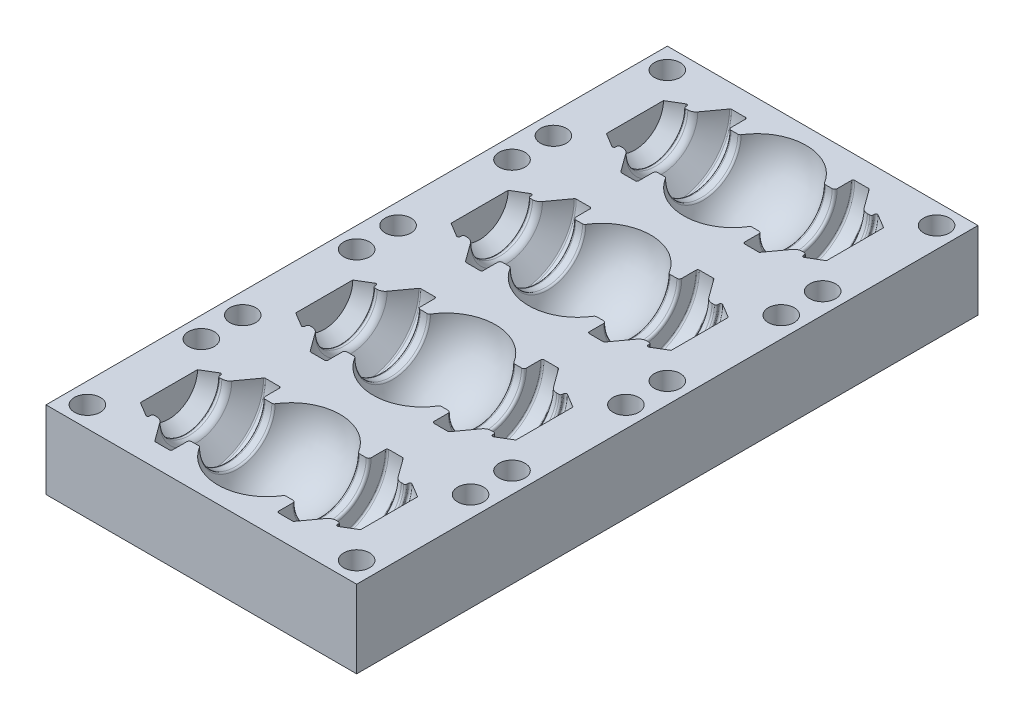
from build123d import *

# Parameters (mm, degrees)
SKETCH1_W                             = 38.1
SKETCH1_H                             = 19.05
BOSS_EXTRUDE1_DEPTH                   = 9.525
F_1_8_0_125_DIAMETER_HOLE1_AT_2_COUNT = 2
F_1_8_0_125_DIAMETER_HOLE1_AT_2_PITCH = 35.853609302
F_1_8_0_125_DIAMETER_HOLE1_AT_3_COUNT = 2
F_1_8_0_125_DIAMETER_HOLE1_AT_3_PITCH = 33.02
F_1_8_0_125_DIAMETER_HOLE1_AT_4_COUNT = 2
F_1_8_0_125_DIAMETER_HOLE1_AT_4_PITCH = 13.97
LPATTERN2_COUNT                       = 4
LPATTERN2_PITCH                       = 19.05


with BuildPart() as part:
    # Sketch1 → Boss-Extrude1 (new body)
    with BuildSketch(Plane(origin=(0, 0, 0), x_dir=(1, 0, 0), z_dir=(0, 1, 0))):
        Rectangle(SKETCH1_W, SKETCH1_H)
    boss_extrude1 = extrude(amount=-BOSS_EXTRUDE1_DEPTH)

    # Sketch2 → Cut-Revolve1 (revolve, cut)
    with BuildSketch(Plane(origin=(0, 0, 0), x_dir=(1, 0, 0), z_dir=(0, 1, 0))):
        with BuildLine():
            Line((-5.370288633, 4.5), (-6.2, 4.5))
            ThreePointArc((-6.2, 4.5), (-6.412132034, 4.587867966), (-6.5, 4.8))
            Line((-6.5, 4.8), (-6.5, 6.55))
            ThreePointArc((-6.5, 6.55), (-6.558578644, 6.691421356), (-6.7, 6.75))
            Line((-6.7, 6.75), (-8.398155082, 6.75))
            ThreePointArc((-8.398155082, 6.75), (-8.488910611, 6.728222989), (-8.559902299, 6.66763434))
            Line((-8.559902299, 6.66763434), (-10.200488507, 4.411828302))
            ThreePointArc((-10.200488507, 4.411828302), (-10.555446947, 4.108885053), (-11.009224592, 4))
            Line((-11.009224592, 4), (-11.3, 4))
            ThreePointArc((-11.3, 4), (-11.441421356, 4.058578644), (-11.5, 4.2))
            Line((-11.5, 4.2), (-11.5, 4.346761924))
            ThreePointArc((-11.5, 4.346761924), (-11.601460237, 4.520801906), (-11.802899151, 4.518260509))
            Line((-11.802899151, 4.518260509), (-13.5, 3.5))
            Line((-13.5, 3.5), (-13.5, 0))
            Line((-13.5, 0), (13.5, 0))
            Line((13.5, 0), (13.5, 3.5))
            Line((13.5, 3.5), (11.802899151, 4.518260509))
            ThreePointArc((11.802899151, 4.518260509), (11.601460237, 4.520801906), (11.5, 4.346761924))
            Line((11.5, 4.346761924), (11.5, 4.2))
            ThreePointArc((11.5, 4.2), (11.441421356, 4.058578644), (11.3, 4))
            Line((11.3, 4), (11.009224592, 4))
            ThreePointArc((11.009224592, 4), (10.555446947, 4.108885053), (10.200488507, 4.411828302))
            Line((10.200488507, 4.411828302), (8.559902299, 6.66763434))
            ThreePointArc((8.559902299, 6.66763434), (8.488910611, 6.728222989), (8.398155082, 6.75))
            Line((8.398155082, 6.75), (6.7, 6.75))
            ThreePointArc((6.7, 6.75), (6.558578644, 6.691421356), (6.5, 6.55))
            Line((6.5, 6.55), (6.5, 4.8))
            ThreePointArc((6.5, 4.8), (6.412132034, 4.587867966), (6.2, 4.5))
            Line((6.2, 4.5), (5.370288633, 4.5))
            ThreePointArc((5.370288633, 4.5), (5.223981013, 4.538095284), (5.114830928, 4.642706131))
            ThreePointArc((5.114830928, 4.642706131), (0, 7.5), (-5.114830928, 4.642706131))
            ThreePointArc((-5.114830928, 4.642706131), (-5.223981013, 4.538095284), (-5.370288633, 4.5))
        make_face()
    cut_revolve1 = revolve(axis=Axis((-13.5, 0, 0), (1, 0, 0)), mode=Mode.SUBTRACT)

    # Sketch6 → 1/8 (0.125) Diameter Hole1 (revolve, cut)
    with BuildSketch(Plane(origin=(-16.51, 0, -6.985), x_dir=(0, 0, 1), z_dir=(1, 0, 0))):
        Polygon((0, 0), (0, 7.303866233), (1.5875, 6.35), (1.5875, 0), align=None)
    f_1_8_0_125_diameter_hole1 = revolve(axis=Axis((-16.51, 6.35, -6.985), (0, -1, 0)), mode=Mode.SUBTRACT)

    # 1/8 (0.125) Diameter Hole1 at 2: 1/8 (0.125) Diameter Hole1 ×2
    with Locations(*[Vector(0.9209672510685588, 0, 0.389639990836698) * (i * F_1_8_0_125_DIAMETER_HOLE1_AT_2_PITCH) for i in range(1, F_1_8_0_125_DIAMETER_HOLE1_AT_2_COUNT)]):
        add(f_1_8_0_125_diameter_hole1, mode=Mode.SUBTRACT)

    # 1/8 (0.125) Diameter Hole1 at 3: 1/8 (0.125) Diameter Hole1 ×2
    with Locations(*[(i * F_1_8_0_125_DIAMETER_HOLE1_AT_3_PITCH, 0, 0) for i in range(1, F_1_8_0_125_DIAMETER_HOLE1_AT_3_COUNT)]):
        add(f_1_8_0_125_diameter_hole1, mode=Mode.SUBTRACT)

    # 1/8 (0.125) Diameter Hole1 at 4: 1/8 (0.125) Diameter Hole1 ×2
    with Locations(*[(0, 0, i * F_1_8_0_125_DIAMETER_HOLE1_AT_4_PITCH) for i in range(1, F_1_8_0_125_DIAMETER_HOLE1_AT_4_COUNT)]):
        add(f_1_8_0_125_diameter_hole1, mode=Mode.SUBTRACT)

    # LPattern2: Boss-Extrude1, Cut-Revolve1, 1/8 (0.125) Diameter Hole1 ×4
    with Locations(*[(0, 0, i * LPATTERN2_PITCH) for i in range(1, LPATTERN2_COUNT)]):
        add(boss_extrude1)
        add(cut_revolve1, mode=Mode.SUBTRACT)
        add(f_1_8_0_125_diameter_hole1, mode=Mode.SUBTRACT)

    # LPattern2 copy 1 sketch → LPattern2 copy 1 (revolve, cut)
    with BuildSketch(Plane(origin=(16.51, 0, 26.035), x_dir=(0, 0, 1), z_dir=(1, 0, 0))):
        Polygon((0, 0), (0, 7.303866233), (1.5875, 6.35), (1.5875, 0), align=None)
    revolve(axis=Axis((16.51, 6.35, 26.035), (0, -1, 0)), mode=Mode.SUBTRACT)

    # LPattern2 copy 2 sketch → LPattern2 copy 2 (revolve, cut)
    with BuildSketch(Plane(origin=(16.51, 0, 45.085), x_dir=(0, 0, 1), z_dir=(1, 0, 0))):
        Polygon((0, 0), (0, 7.303866233), (1.5875, 6.35), (1.5875, 0), align=None)
    revolve(axis=Axis((16.51, 6.35, 45.085), (0, -1, 0)), mode=Mode.SUBTRACT)

    # LPattern2 copy 3 sketch → LPattern2 copy 3 (revolve, cut)
    with BuildSketch(Plane(origin=(16.51, 0, 64.135), x_dir=(0, 0, 1), z_dir=(1, 0, 0))):
        Polygon((0, 0), (0, 7.303866233), (1.5875, 6.35), (1.5875, 0), align=None)
    revolve(axis=Axis((16.51, 6.35, 64.135), (0, -1, 0)), mode=Mode.SUBTRACT)

    # LPattern2 copy 4 sketch → LPattern2 copy 4 (revolve, cut)
    with BuildSketch(Plane(origin=(16.51, 0, 12.065), x_dir=(0, 0, 1), z_dir=(1, 0, 0))):
        Polygon((0, 0), (0, 7.303866233), (1.5875, 6.35), (1.5875, 0), align=None)
    revolve(axis=Axis((16.51, 6.35, 12.065), (0, -1, 0)), mode=Mode.SUBTRACT)

    # LPattern2 copy 5 sketch → LPattern2 copy 5 (revolve, cut)
    with BuildSketch(Plane(origin=(16.51, 0, 31.115), x_dir=(0, 0, 1), z_dir=(1, 0, 0))):
        Polygon((0, 0), (0, 7.303866233), (1.5875, 6.35), (1.5875, 0), align=None)
    revolve(axis=Axis((16.51, 6.35, 31.115), (0, -1, 0)), mode=Mode.SUBTRACT)

    # LPattern2 copy 6 sketch → LPattern2 copy 6 (revolve, cut)
    with BuildSketch(Plane(origin=(16.51, 0, 50.165), x_dir=(0, 0, 1), z_dir=(1, 0, 0))):
        Polygon((0, 0), (0, 7.303866233), (1.5875, 6.35), (1.5875, 0), align=None)
    revolve(axis=Axis((16.51, 6.35, 50.165), (0, -1, 0)), mode=Mode.SUBTRACT)

    # LPattern2 copy 7 sketch → LPattern2 copy 7 (revolve, cut)
    with BuildSketch(Plane(origin=(-16.51, 0, 26.035), x_dir=(0, 0, 1), z_dir=(1, 0, 0))):
        Polygon((0, 0), (0, 7.303866233), (1.5875, 6.35), (1.5875, 0), align=None)
    revolve(axis=Axis((-16.51, 6.35, 26.035), (0, -1, 0)), mode=Mode.SUBTRACT)

    # LPattern2 copy 8 sketch → LPattern2 copy 8 (revolve, cut)
    with BuildSketch(Plane(origin=(-16.51, 0, 45.085), x_dir=(0, 0, 1), z_dir=(1, 0, 0))):
        Polygon((0, 0), (0, 7.303866233), (1.5875, 6.35), (1.5875, 0), align=None)
    revolve(axis=Axis((-16.51, 6.35, 45.085), (0, -1, 0)), mode=Mode.SUBTRACT)

    # LPattern2 copy 9 sketch → LPattern2 copy 9 (revolve, cut)
    with BuildSketch(Plane(origin=(-16.51, 0, 64.135), x_dir=(0, 0, 1), z_dir=(1, 0, 0))):
        Polygon((0, 0), (0, 7.303866233), (1.5875, 6.35), (1.5875, 0), align=None)
    revolve(axis=Axis((-16.51, 6.35, 64.135), (0, -1, 0)), mode=Mode.SUBTRACT)


solid = part.part
